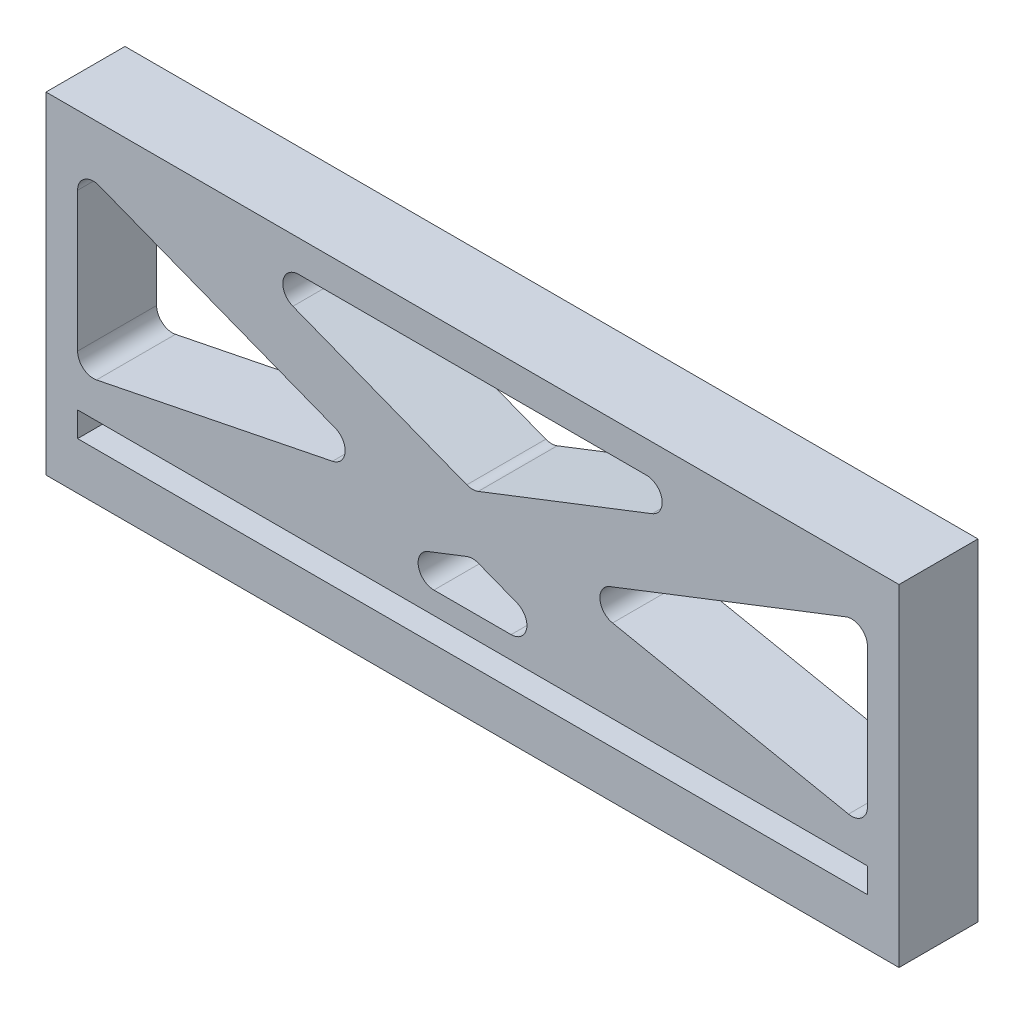
from build123d import *

# Parameters (mm, degrees)
SKETCH1_W           = 68.58
SKETCH1_H           = 26.67
SKETCH1_W_2         = 63.5
SKETCH1_H_2         = 2
BOSS_EXTRUDE1_DEPTH = 6.35
FILLET1_R           = 1.27


with BuildPart() as part:
    # Sketch1 → Boss-Extrude1 (new body)
    with BuildSketch(Plane.XY):
        Rectangle(SKETCH1_W, SKETCH1_H)
        Polygon((-20.750635985, 10.795), (0, 2.725308228), (20.750635985, 10.795), align=None, mode=Mode.SUBTRACT)
        with Locations((0, -8.525)):
            Rectangle(SKETCH1_W_2, SKETCH1_H_2, mode=Mode.SUBTRACT)
        Polygon((-31.75, 9.621913994), (-31.75, -4.985), (-7.007935444, 0), align=None, mode=Mode.SUBTRACT)
        Polygon((7.007935444, 0), (31.75, 9.621913994), (31.75, -4.985), align=None, mode=Mode.SUBTRACT)
        Polygon((0, -1.90771576), (-9.872445189, -5.747), (9.872445189, -5.747), align=None, mode=Mode.SUBTRACT)
    extrude(amount=BOSS_EXTRUDE1_DEPTH)

    # Fillet1
    fillet1_edges = [part.edges().sort_by_distance(p)[0] for p in [
        (20.750635985, 10.795, 3.175),
        (-20.750635985, 10.795, 3.175),
        (0, 2.725308228, 3.175),
        (-7.007935444, 0, 3.175),
        (-31.75, 9.621913994, 3.175),
        (-31.75, -4.985, 3.175),
        (7.007935444, 0, 3.175),
        (31.75, -4.985, 3.175),
        (31.75, 9.621913994, 3.175),
        (9.872445189, -5.747, 3.175),
        (0, -1.90771576, 3.175),
        (-9.872445189, -5.747, 3.175),
    ]]
    fillet(fillet1_edges, radius=FILLET1_R)


solid = part.part
